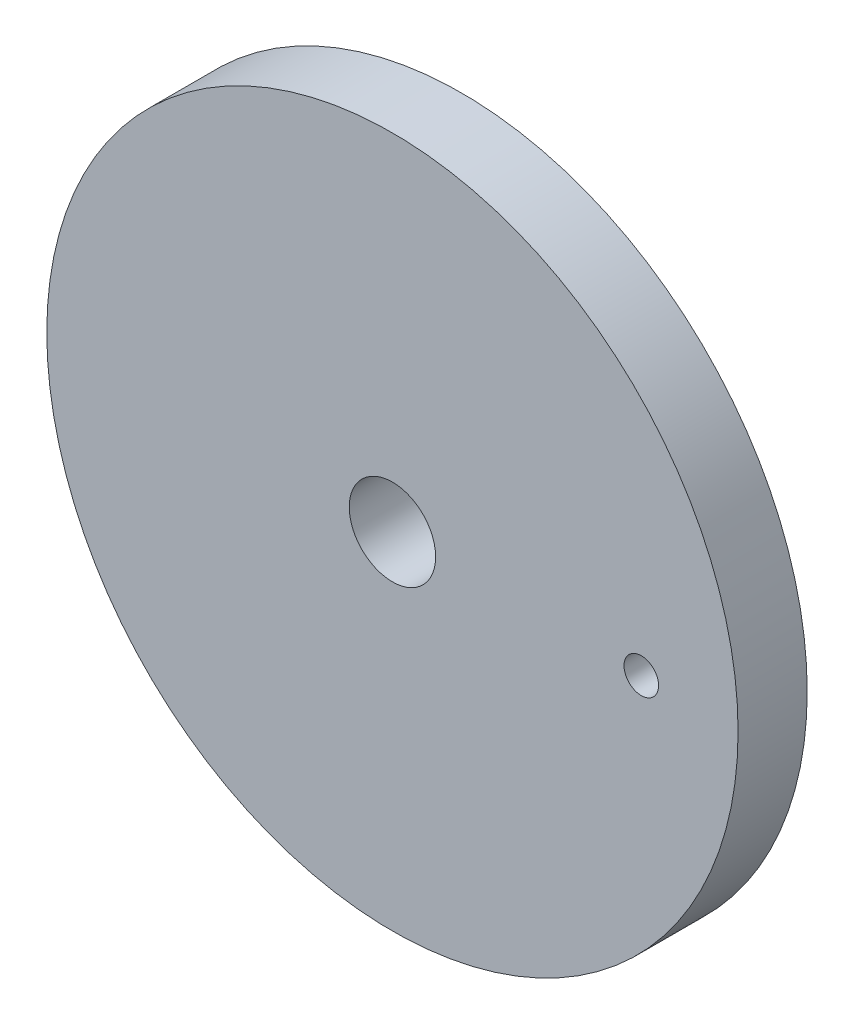
from build123d import *

# Parameters (mm, degrees)
SKETCH_1_R      = 50
SKETCH_1_R_2    = 6.25
SKETCH_1_R_3    = 2.5
EXTRUDE_1_DEPTH = 10


with BuildPart() as part:
    # 草图1 → 凸台-拉伸1 (new body)
    with BuildSketch(Plane.XY):
        Circle(SKETCH_1_R)
        Circle(SKETCH_1_R_2, mode=Mode.SUBTRACT)
        with Locations((36, 0)):
            Circle(SKETCH_1_R_3, mode=Mode.SUBTRACT)
    extrude(amount=EXTRUDE_1_DEPTH)


solid = part.part
